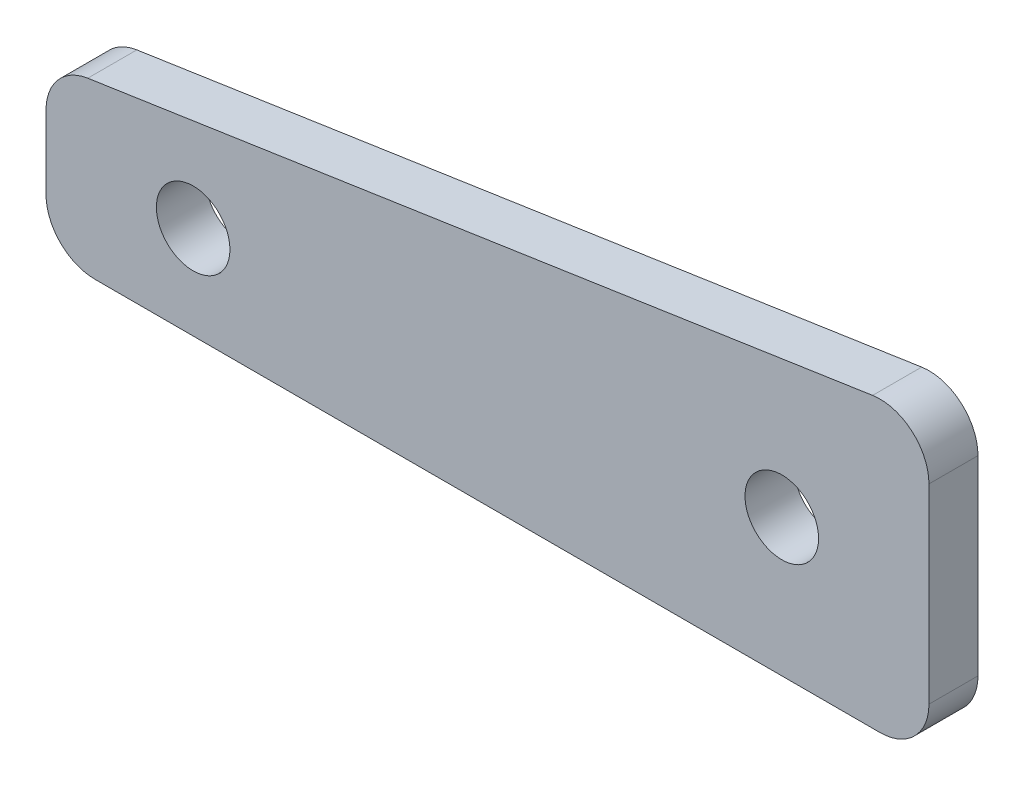
from build123d import *

# Parameters (mm, degrees)
BOSS_EXTRUDE1_DEPTH = 3.175


with BuildPart() as part:
    # Sketch1 → Boss-Extrude1 (new body)
    with BuildSketch(Plane.XY):
        with BuildLine():
            Line((-342.9, 12.065), (-349.720980938, 11.041852859))
            ThreePointArc((-349.720980938, 11.041852859), (-351.655825168, 9.97384631), (-352.425, 7.901979939))
            Line((-352.425, 7.901979939), (-352.425, 3.175))
            ThreePointArc((-352.425, 3.175), (-351.49506403, 0.92993597), (-349.25, 0))
            Line((-349.25, 0), (-342.9, 0))
            Line((-342.9, 0), (-342.9, 3.65125))
            ThreePointArc((-342.9, 3.65125), (-345.28125, 6.0325), (-342.9, 8.41375))
            Line((-342.9, 8.41375), (-342.9, 12.065))
        make_face()
        with BuildLine():
            Line((-304.8, 17.78), (-342.9, 12.065))
            Line((-342.9, 12.065), (-342.9, 8.41375))
            ThreePointArc((-342.9, 8.41375), (-341.216201977, 7.716298023), (-340.51875, 6.0325))
            ThreePointArc((-340.51875, 6.0325), (-341.216201977, 4.348701977), (-342.9, 3.65125))
            Line((-342.9, 3.65125), (-342.9, 0))
            Line((-342.9, 0), (-304.8, 0))
            Line((-304.8, 0), (-304.8, 6.50875))
            ThreePointArc((-304.8, 6.50875), (-307.18125, 8.89), (-304.8, 11.27125))
            Line((-304.8, 11.27125), (-304.8, 17.78))
        make_face()
        with BuildLine():
            Line((-298.920980938, 18.661852859), (-304.8, 17.78))
            Line((-304.8, 17.78), (-304.8, 11.27125))
            ThreePointArc((-304.8, 11.27125), (-303.116201977, 10.573798023), (-302.41875, 8.89))
            ThreePointArc((-302.41875, 8.89), (-303.116201977, 7.206201977), (-304.8, 6.50875))
            Line((-304.8, 6.50875), (-304.8, 0))
            Line((-304.8, 0), (-298.45, 0))
            ThreePointArc((-298.45, 0), (-296.20493597, 0.92993597), (-295.275, 3.175))
            Line((-295.275, 3.175), (-295.275, 15.521979939))
            ThreePointArc((-295.275, 15.521979939), (-296.378133629, 17.927805107), (-298.920980938, 18.661852859))
        make_face()
    extrude(amount=BOSS_EXTRUDE1_DEPTH)


solid = part.part
